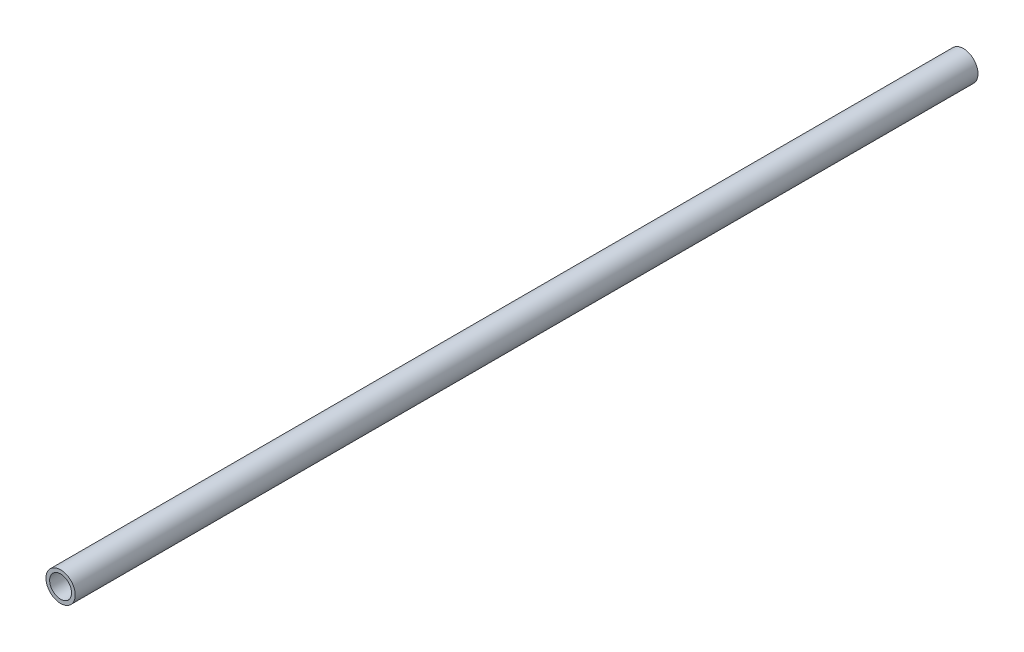
from build123d import *

# Parameters (mm, degrees)
MODEL_R         = 4
MODEL_R_2       = 3
EXTRUDE_1_DEPTH = 247


with BuildPart() as part:
    # Model → 凸台-拉伸1 (new body)
    with BuildSketch(Plane.XY):
        with Locations((21.144511566, 12.491138445)):
            Circle(MODEL_R)
        with Locations((21.144511566, 12.491138445)):
            Circle(MODEL_R_2, mode=Mode.SUBTRACT)
    extrude(amount=EXTRUDE_1_DEPTH)


solid = part.part
